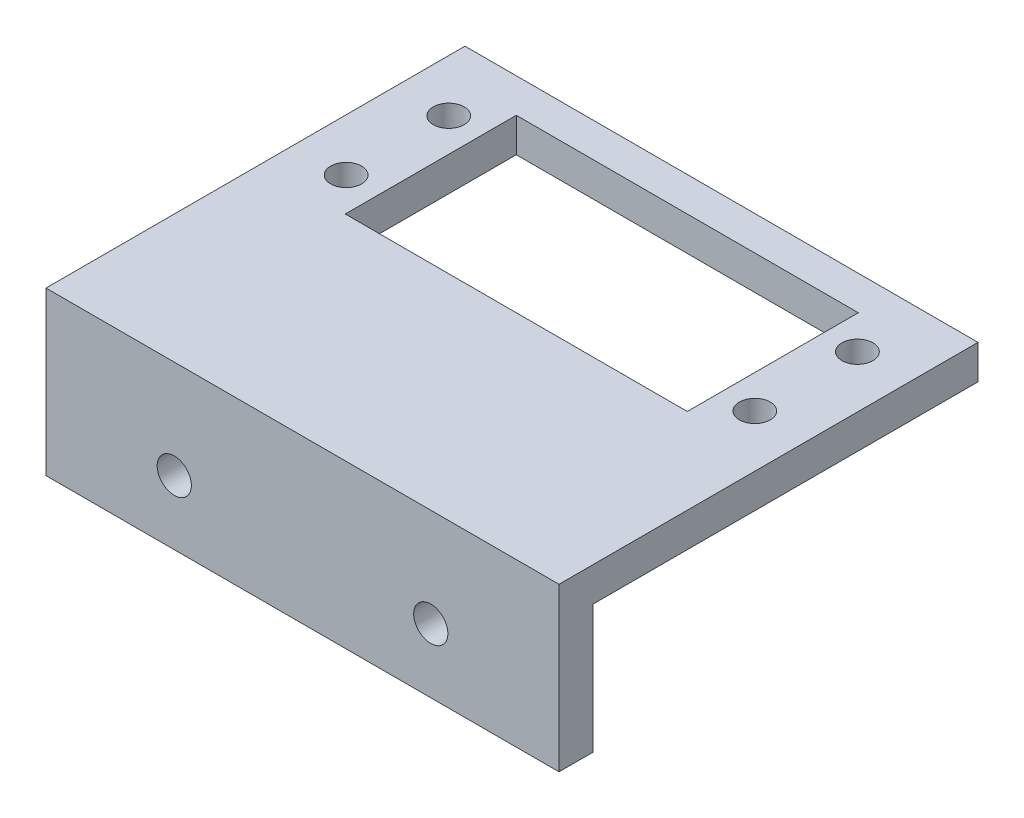
from build123d import *

# Parameters (mm, degrees)
SKETCH1_W           = 60
SKETCH1_H           = 50
BOSS_EXTRUDE1_DEPTH = 4
SKETCH2_W           = 60
SKETCH2_H           = 4
BOSS_EXTRUDE2_DEPTH = 45
SKETCH3_W           = 40
SKETCH3_H           = 20
CUT_EXTRUDE1_DEPTH  = 60
SKETCH4_W           = 60
SKETCH4_H           = 31
CUT_EXTRUDE2_DEPTH  = 10
SKETCH5_R           = 2
CUT_EXTRUDE3_DEPTH  = 60.581876439
SKETCH6_R           = 1.81
CUT_EXTRUDE4_DEPTH  = 10
SKETCH7_R           = 1.81
CUT_EXTRUDE5_DEPTH  = 58.323642592


with BuildPart() as part:
    # Sketch1 → Boss-Extrude1 (new body)
    with BuildSketch(Plane.XY):
        Rectangle(SKETCH1_W, SKETCH1_H)
    extrude(amount=BOSS_EXTRUDE1_DEPTH)

    # Sketch2 → Boss-Extrude2 (add)
    with BuildSketch(Plane(origin=(0, 0, 0), x_dir=(-1, 0, 0), z_dir=(0, 0, -1))):
        with Locations((0, 23)):
            Rectangle(SKETCH2_W, SKETCH2_H)
    extrude(amount=BOSS_EXTRUDE2_DEPTH)

    # Sketch3 → Cut-Extrude1 (cut)
    with BuildSketch(Plane(origin=(0, 25, 0), x_dir=(1, 0, 0), z_dir=(0, 1, 0))):
        with Locations((0, 31)):
            Rectangle(SKETCH3_W, SKETCH3_H)
    extrude(amount=-CUT_EXTRUDE1_DEPTH, mode=Mode.SUBTRACT)

    # Sketch4 → Cut-Extrude2 (cut)
    with BuildSketch(Plane(origin=(0, 0, 0), x_dir=(-1, 0, 0), z_dir=(0, 0, -1))):
        with Locations((0, -9.5)):
            Rectangle(SKETCH4_W, SKETCH4_H)
    extrude(amount=-CUT_EXTRUDE2_DEPTH, mode=Mode.SUBTRACT)

    # Sketch5 → Cut-Extrude3 (cut, through all)
    with BuildSketch(Plane(origin=(0, 0, 0), x_dir=(-1, 0, 0), z_dir=(0, 0, -1))):
        with Locations((-15, 13.5)):
            Circle(SKETCH5_R)
        with Locations((15, 13.5)):
            Circle(SKETCH5_R)
    extrude(amount=-CUT_EXTRUDE3_DEPTH, mode=Mode.SUBTRACT)

    # Sketch6 → Cut-Extrude4 (cut)
    with BuildSketch(Plane(origin=(0, 25, 0), x_dir=(1, 0, 0), z_dir=(0, 1, 0))):
        with Locations(Location((23.9, 25, 0), (0, 0, 270))):
            Circle(SKETCH6_R)
        with Locations(Location((23.9, 37, 0), (0, 0, 270))):
            Circle(SKETCH6_R)
    extrude(amount=-CUT_EXTRUDE4_DEPTH, mode=Mode.SUBTRACT)

    # Sketch7 → Cut-Extrude5 (cut, through all)
    with BuildSketch(Plane(origin=(0, 25, 0), x_dir=(1, 0, 0), z_dir=(0, 1, 0))):
        with Locations(Location((-23.9, 37, 0), (0, 0, 270))):
            Circle(SKETCH7_R)
        with Locations(Location((-23.9, 25, 0), (0, 0, 270))):
            Circle(SKETCH7_R)
    extrude(amount=-CUT_EXTRUDE5_DEPTH, mode=Mode.SUBTRACT)


solid = part.part
